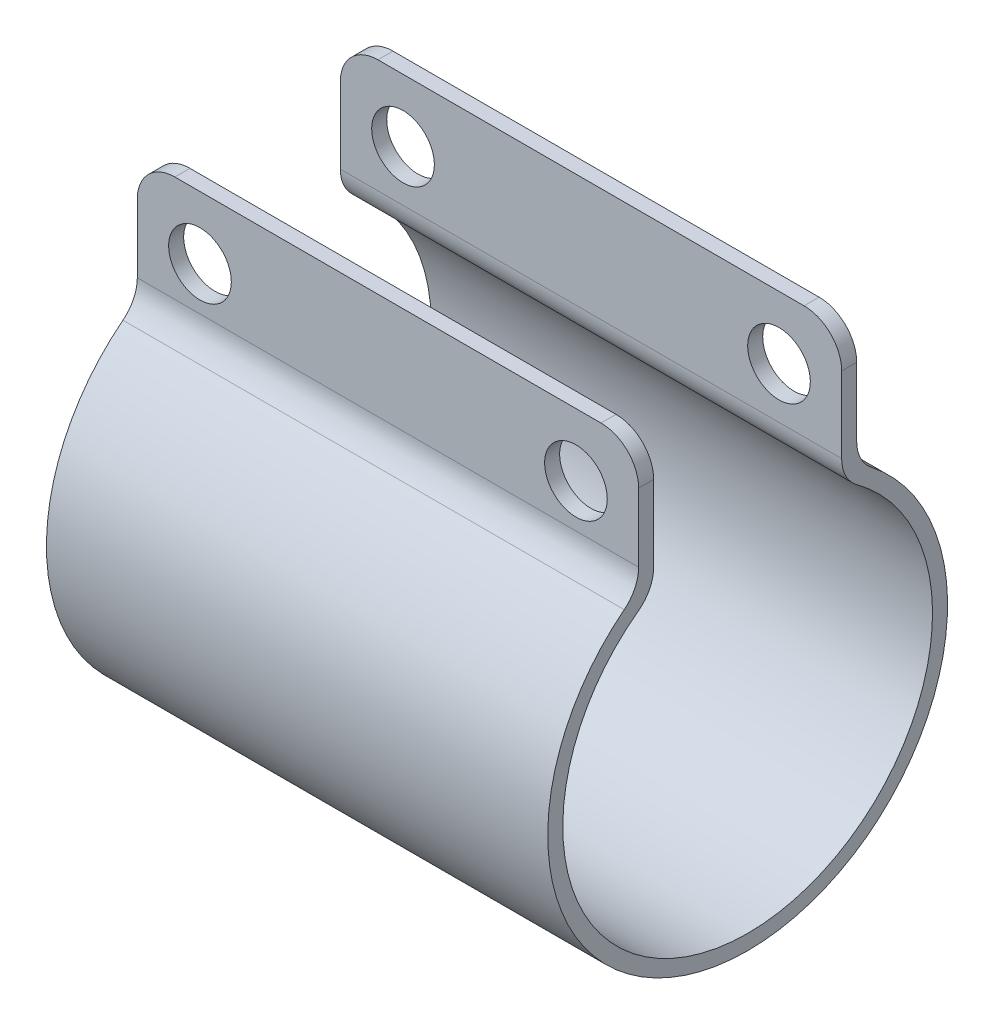
from build123d import *

# Parameters (mm, degrees)
BOSS_EXTRUDE1_DEPTH     = 50.8
CUT_EXTRUDE1_DEPTH      = 63.223284049
CUT_EXTRUDE1_DEPTH_BACK = 63.223284049
SKETCH2_R               = 3.175
FILLET1_R               = 3.81


with BuildPart() as part:
    # Sketch1 → Boss-Extrude1 (new body)
    with BuildSketch(Plane(origin=(0, 0, 0), x_dir=(0, 0, -1), z_dir=(1, 0, 0))):
        with BuildLine():
            Line((9.525, 16.130124961), (9.525, 29.677791118))
            Line((9.525, 29.677791118), (11.049, 29.677791118))
            Line((11.049, 29.677791118), (11.049, 16.977791118))
            ThreePointArc((11.049, 16.977791118), (0, -20.2565), (-11.049, 16.977791118))
            Line((-11.049, 16.977791118), (-11.049, 29.677791118))
            Line((-11.049, 29.677791118), (-9.525, 29.677791118))
            Line((-9.525, 29.677791118), (-9.525, 16.130124961))
            ThreePointArc((-9.525, 16.130124961), (0, -18.7325), (9.525, 16.130124961))
        make_face()
    extrude(amount=BOSS_EXTRUDE1_DEPTH)

    # Sketch2 → Cut-Extrude1 (cut, two sides: drawn at the far end of the back side and taken through both)
    with BuildSketch(Plane.XY.offset(-CUT_EXTRUDE1_DEPTH_BACK)):
        with Locations(Location((6.35, 23.327791118, 0), (0, 0, 270))):
            Circle(SKETCH2_R)
        with Locations(Location((44.45, 23.327791118, 0), (0, 0, 270))):
            Circle(SKETCH2_R)
    extrude(amount=CUT_EXTRUDE1_DEPTH + CUT_EXTRUDE1_DEPTH_BACK, mode=Mode.SUBTRACT)

    # Fillet1
    fillet1_edges = [part.edges().sort_by_distance(p)[0] for p in [
        (0, 29.677791118, 10.287),
        (50.8, 29.677791118, 10.287),
        (25.4, 16.130124961, -9.525),
        (25.4, 16.977791118, -11.049),
        (25.4, 16.977791118, 11.049),
        (25.4, 16.130124961, 9.525),
        (50.8, 29.677791118, -10.287),
        (0, 29.677791118, -10.287),
    ]]
    fillet(fillet1_edges, radius=FILLET1_R)


solid = part.part
